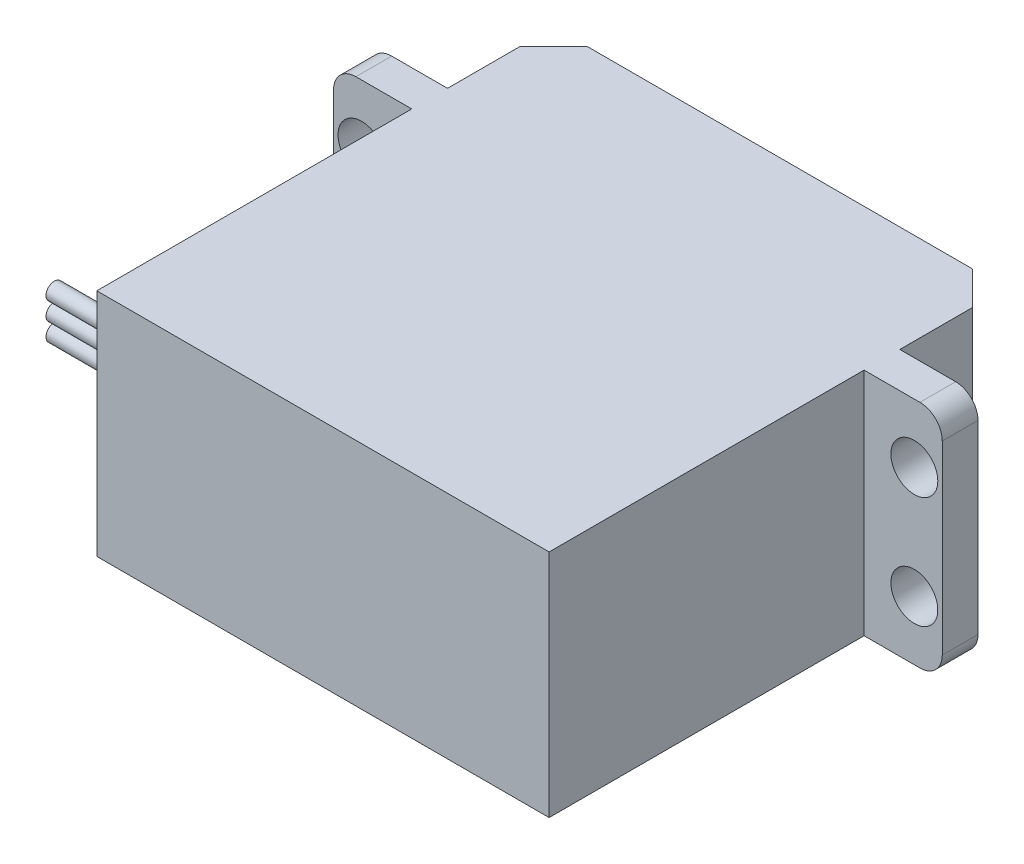
from build123d import *

# Parameters (mm, degrees)
BOSS_EXTRU_1_DEPTH                = 10.3
ESQUISSE3_W                       = 7
ESQUISSE3_H                       = 20.6
ESQUISSE3_R                       = 2.1
BOSS_EXTRU_2_DEPTH                = 3.2
BOSS_EXTRU_3_DEPTH                = 0.85
ESQUISSE8_R                       = 6.75
BOSS_EXTRU_7_DEPTH                = 1
ESQUISSE5_R                       = 2.925
BOSS_EXTRU_4_DEPTH                = 4.3
CONG_1_R                          = 2
ESQUISSE6_W                       = 3
ESQUISSE6_H                       = 6.8
BOSS_EXTRU_5_DEPTH                = 5.3
ESQUISSE7_R                       = 0.75
BOSS_EXTRU_6_DEPTH                = 5.3
DIAM_TRE_DU_PER_AGE_3_0_3_1_D     = 3
DIAM_TRE_DU_PER_AGE_3_0_3_1_DEPTH = 6
DIAM_TRE_DU_PER_AGE_3_0_3_1_TIP   = 0.901290929


with BuildPart() as part:
    # Esquisse1 → Boss.-Extru.1 (new, symmetric)
    with BuildSketch(Plane(origin=(0, 0, 0), x_dir=(1, 0, 0), z_dir=(0, 1, 0))):
        Polygon((-17.25, 12.7), (17.25, 12.7), (20.25, 9.7), (20.25, -28.2), (-20.25, -28.2), (-20.25, 9.7), align=None)
    extrude(amount=BOSS_EXTRU_1_DEPTH, both=True)

    # Esquisse3 → Boss.-Extru.2 (add)
    # profile 1 of 2: a face of its own
    with BuildSketch(Plane.XY):
        with Locations((23.75, 0)):
            Rectangle(ESQUISSE3_W, ESQUISSE3_H)
        with Locations((24.75, 5)):
            Circle(ESQUISSE3_R, mode=Mode.SUBTRACT)
        with Locations(Location((24.75, -5, 0), (0, 0, 180))):
            Circle(ESQUISSE3_R, mode=Mode.SUBTRACT)
    # profile 2 of 2: a face of its own
    with BuildSketch(Plane.XY):
        with Locations((-23.75, 0)):
            Rectangle(ESQUISSE3_W, ESQUISSE3_H)
        with Locations(Location((-24.75, 5, 0), (0, 0, 180))):
            Circle(ESQUISSE3_R, mode=Mode.SUBTRACT)
        with Locations((-24.75, -5)):
            Circle(ESQUISSE3_R, mode=Mode.SUBTRACT)
    extrude(amount=-BOSS_EXTRU_2_DEPTH)

    # Esquisse4 → Boss.-Extru.3 (add, symmetric)
    with BuildSketch(Plane(origin=(0, 0, 0), x_dir=(1, 0, 0), z_dir=(0, 1, 0))):
        Polygon((20.25, 3.2), (20.25, 5.1), (21.65, 5.1), (25.9, 3.7), (25.9, 3.2), align=None)
        Polygon((-25.9, 3.2), (-20.25, 3.2), (-20.25, 5.1), (-21.65, 5.1), (-25.9, 3.7), align=None)
    extrude(amount=BOSS_EXTRU_3_DEPTH, both=True)

    # Esquisse8 → Boss.-Extru.7 (add)
    with BuildSketch(Plane(origin=(0, 0, -12.7), x_dir=(-1, 0, 0), z_dir=(0, 0, -1))):
        with Locations(Location((10, 0, 0), (0, 0, 180))):
            Circle(ESQUISSE8_R)
    extrude(amount=BOSS_EXTRU_7_DEPTH)

    # Esquisse5 → Boss.-Extru.4 (add)
    with BuildSketch(Plane(origin=(0, 0, -13.7), x_dir=(-1, 0, 0), z_dir=(0, 0, -1))):
        with Locations(Location((10, 0, 0), (0, 0, 180))):
            Circle(ESQUISSE5_R)
    extrude(amount=BOSS_EXTRU_4_DEPTH)

    # Congé1
    cong_1_edges = [part.edges().sort_by_distance(p)[0] for p in [
        (27.25, 10.3, -1.6),
        (27.25, -10.3, -1.6),
        (-27.25, -10.3, -1.6),
        (-27.25, 10.3, -1.6),
    ]]
    fillet(cong_1_edges, radius=CONG_1_R)

    # Esquisse6 → Boss.-Extru.5 (add)
    with BuildSketch(Plane.ZY.offset(20.25)):
        with Locations((21.4, 0)):
            Rectangle(ESQUISSE6_W, ESQUISSE6_H)
    extrude(amount=BOSS_EXTRU_5_DEPTH)

    # Esquisse7 → Boss.-Extru.6 (add)
    with BuildSketch(Plane.ZY.offset(25.55)):
        with Locations((21.4, 0)):
            Circle(ESQUISSE7_R)
        with Locations((21.4, 1.6)):
            Circle(ESQUISSE7_R)
        with Locations(Location((21.4, -1.6, 0), (0, 0, 180))):
            Circle(ESQUISSE7_R)
    extrude(amount=BOSS_EXTRU_6_DEPTH)

    # Diamètre du perçage Ø3.0 (3)1
    with Locations(Plane(origin=(0, 0, -18), x_dir=(-1, 0, 0), z_dir=(0, 0, -1))):
        with Locations((10, 0)):
            Hole(DIAM_TRE_DU_PER_AGE_3_0_3_1_D / 2, depth=DIAM_TRE_DU_PER_AGE_3_0_3_1_DEPTH)
            with Locations((0, 0, -(DIAM_TRE_DU_PER_AGE_3_0_3_1_DEPTH + DIAM_TRE_DU_PER_AGE_3_0_3_1_TIP / 2))):  # 118° drill point
                Cone(0, DIAM_TRE_DU_PER_AGE_3_0_3_1_D / 2, DIAM_TRE_DU_PER_AGE_3_0_3_1_TIP, mode=Mode.SUBTRACT)


solid = part.part
